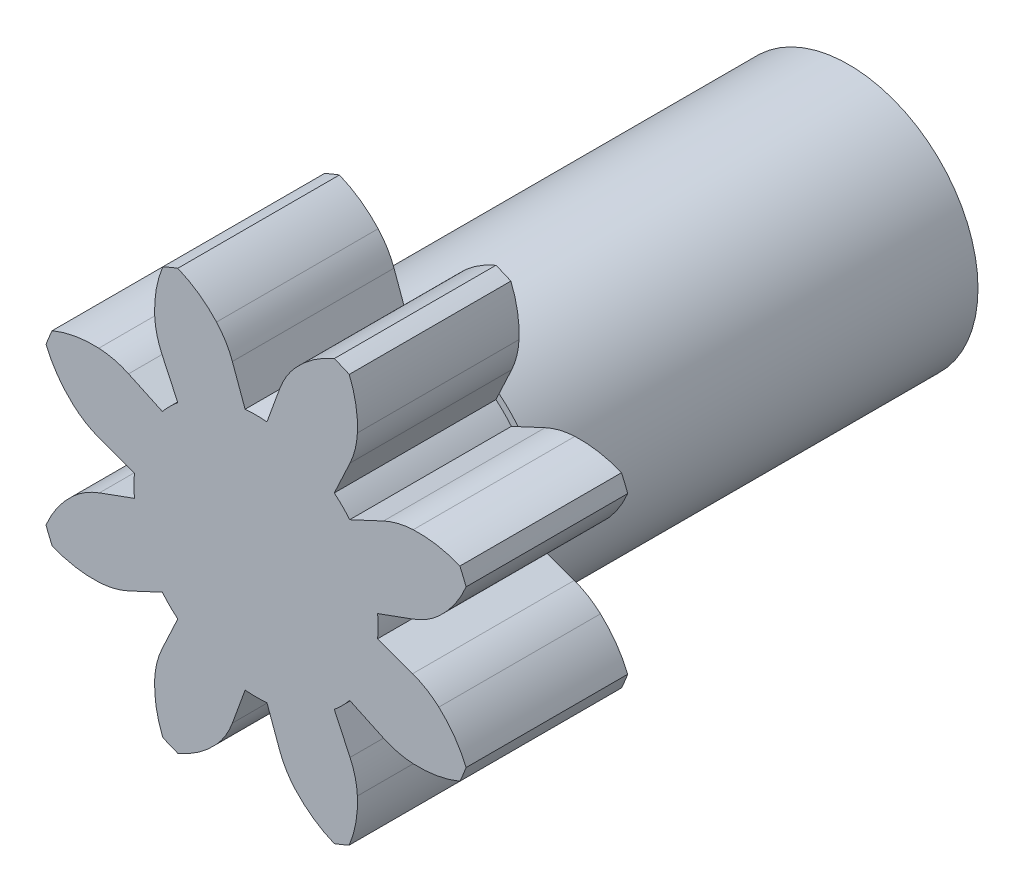
from build123d import *

# Parameters (mm, degrees)
ESBO_O2_R                = 10.4
RESSALTO_EXTRUS_O1_DEPTH = 7.5
CORTE_EXTRUS_O1_DEPTH    = 17.509694122
PADR_OCIRCULAR2_COUNT    = 8
ESBO_O3_R                = 6
RESSALTO_EXTRUS_O2_DEPTH = 20


with BuildPart() as part:
    # Esboço2 → Ressalto-extrusão1 (new body)
    with BuildSketch(Plane.XY):
        Circle(ESBO_O2_R)
    extrude(amount=RESSALTO_EXTRUS_O1_DEPTH)

    # Esboço1 → Corte-extrusão1 (cut, through all)
    with BuildSketch(Plane.XY):
        with BuildLine():
            Line((-0.506751832, 5.642289215), (-1.097919721, 7.266509641))
            ThreePointArc((-1.097919721, 7.266509641), (-1.406126414, 7.910707201), (-1.832951119, 8.483247621))
            ThreePointArc((-1.832951119, 8.483247621), (-2.661618953, 9.214061597), (-3.630088541, 9.745894376))
            ThreePointArc((-3.630088541, 9.745894376), (0, 10.4), (3.630088541, 9.745894376))
            ThreePointArc((3.630088541, 9.745894376), (2.661618953, 9.214061597), (1.832951119, 8.483247621))
            ThreePointArc((1.832951119, 8.483247621), (1.406126414, 7.910707201), (1.097919721, 7.266509641))
            Line((1.097919721, 7.266509641), (0.506751832, 5.642289215))
            ThreePointArc((0.506751832, 5.642289215), (0, 5.665), (-0.506751832, 5.642289215))
        make_face()
    corte_extrus_o1 = extrude(amount=CORTE_EXTRUS_O1_DEPTH, mode=Mode.SUBTRACT)

    # PadrãoCircular2: Corte-extrusão1 ×8 about axis
    padr_ocircular2_axis = Axis((0, 0, 0), (0, 0, 1))
    for i in range(1, PADR_OCIRCULAR2_COUNT):
        add(corte_extrus_o1.rotate(padr_ocircular2_axis, i * 360 / PADR_OCIRCULAR2_COUNT), mode=Mode.SUBTRACT)

    # Esboço3 → Ressalto-extrusão2 (add)
    with BuildSketch(Plane(origin=(0, 0, 0), x_dir=(-1, 0, 0), z_dir=(0, 0, -1))):
        with Locations(Location((0, 0, 0), (0, 0, 174.020217927))):
            Circle(ESBO_O3_R)
    extrude(amount=RESSALTO_EXTRUS_O2_DEPTH)


solid = part.part
